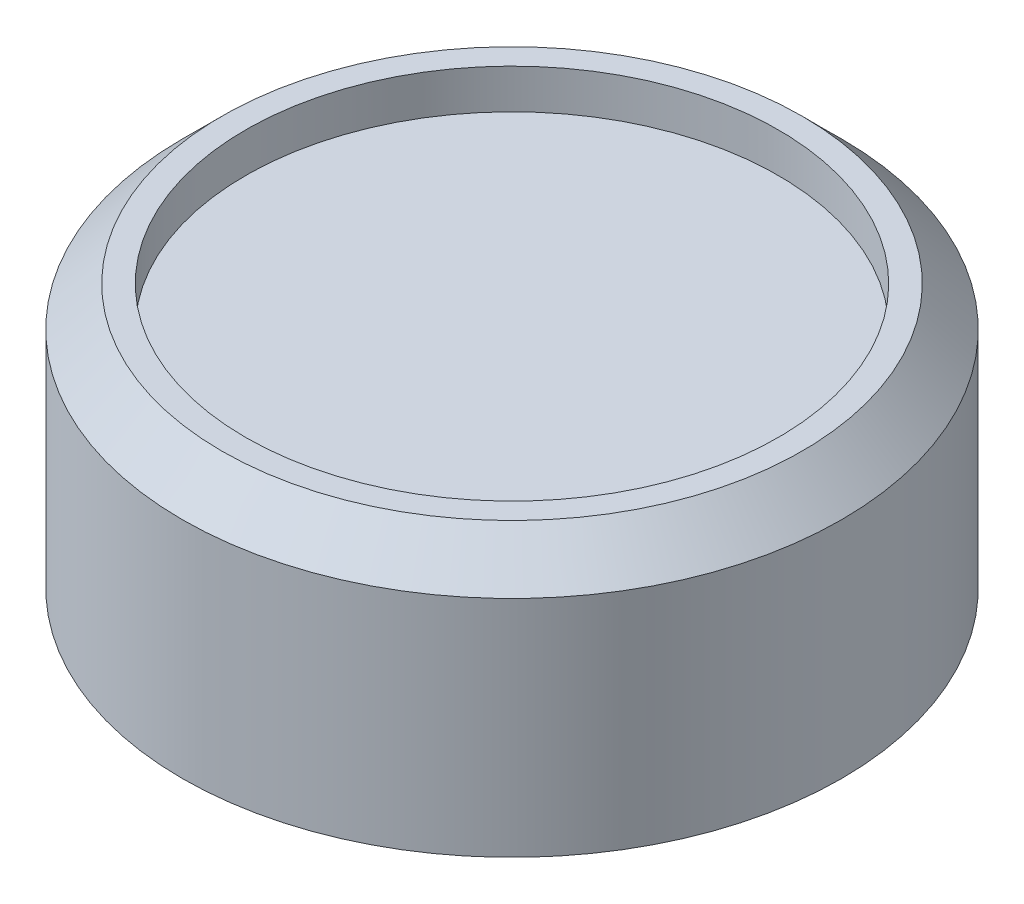
from build123d import *

# Parameters (mm, degrees)
SKETCH1_R           = 12.5
BOSS_EXTRUDE1_DEPTH = 10
CUT_EXTRUDE1_DEPTH  = 8
CHAMFER1_SIZE       = 1.5
SKETCH5_R           = 10
CUT_EXTRUDE2_DEPTH  = 6
SKETCH6_R           = 10.1
CUT_EXTRUDE3_DEPTH  = 1.5


with BuildPart() as part:
    # Sketch1 → Boss-Extrude1 (new body)
    with BuildSketch(Plane(origin=(0, 0, 0), x_dir=(1, 0, 0), z_dir=(0, 1, 0))):
        with Locations(Location((0, 0, 0), (0, 0, 270))):
            Circle(SKETCH1_R)
    extrude(amount=BOSS_EXTRUDE1_DEPTH)

    # Sketch2 → Cut-Extrude1 (cut)
    with BuildSketch(Plane.XZ):
        Polygon((7.736493607, 0), (3.868246804, 6.7), (-3.868246804, 6.7), (-7.736493607, 0), (-3.868246804, -6.7), (3.868246804, -6.7), align=None)
    extrude(amount=-CUT_EXTRUDE1_DEPTH, mode=Mode.SUBTRACT)

    # Chamfer1
    chamfer1_edges = [part.edges().sort_by_distance(p)[0] for p in [
        (0, 10, -12.5),
    ]]
    chamfer(chamfer1_edges, length=CHAMFER1_SIZE)

    # Sketch5 → Cut-Extrude2 (cut)
    with BuildSketch(Plane(origin=(0, 2.3, 0), x_dir=(-1, 0, 0), z_dir=(0, -1, 0))):
        with Locations(Location((0, 0, 0), (0, 0, 270))):
            Circle(SKETCH5_R)
    extrude(amount=CUT_EXTRUDE2_DEPTH, mode=Mode.SUBTRACT)

    # Sketch6 → Cut-Extrude3 (cut)
    with BuildSketch(Plane(origin=(0, 10, 0), x_dir=(1, 0, 0), z_dir=(0, 1, 0))):
        with Locations(Location((0, 0, 0), (0, 0, 270))):
            Circle(SKETCH6_R)
    extrude(amount=-CUT_EXTRUDE3_DEPTH, mode=Mode.SUBTRACT)


solid = part.part
